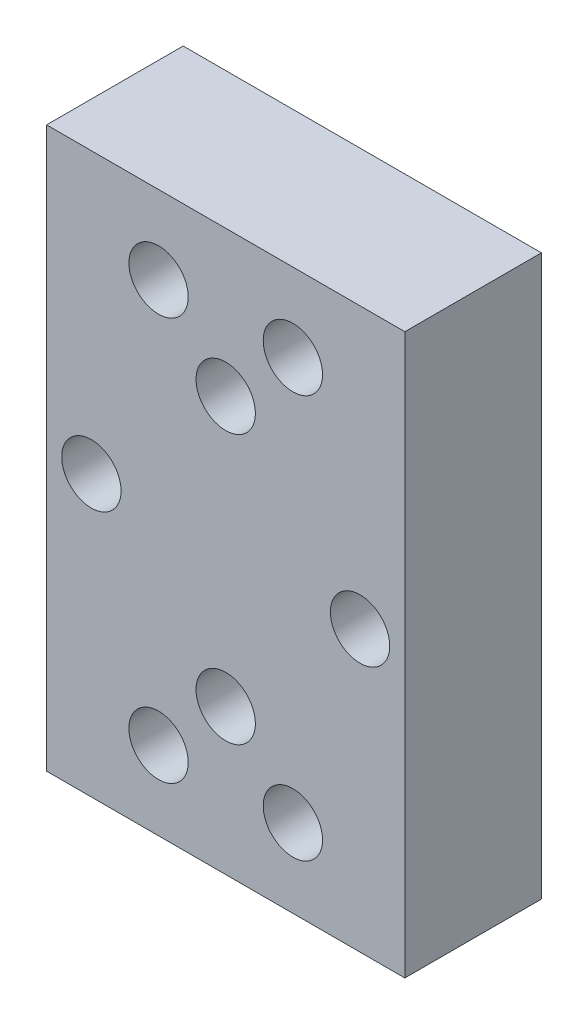
from build123d import *

# Parameters (mm, degrees)
SKETCH1_W           = 16
SKETCH1_H           = 25
SKETCH1_R           = 1.325
BOSS_EXTRUDE1_DEPTH = 6.1


with BuildPart() as part:
    # Sketch1 → Boss-Extrude1 (new body)
    with BuildSketch(Plane.XY):
        with Locations((8, 12.5)):
            Rectangle(SKETCH1_W, SKETCH1_H)
        with Locations((2, 12.5)):
            Circle(SKETCH1_R, mode=Mode.SUBTRACT)
        with Locations((8, 18.5)):
            Circle(SKETCH1_R, mode=Mode.SUBTRACT)
        with Locations((5, 21.5)):
            Circle(SKETCH1_R, mode=Mode.SUBTRACT)
        with Locations(Location((14, 12.5, 0), (0, 0, 180))):
            Circle(SKETCH1_R, mode=Mode.SUBTRACT)
        with Locations(Location((11, 21.5, 0), (0, 0, 180))):
            Circle(SKETCH1_R, mode=Mode.SUBTRACT)
        with Locations(Location((5, 3.5, 0), (0, 0, 180))):
            Circle(SKETCH1_R, mode=Mode.SUBTRACT)
        with Locations((11, 3.5)):
            Circle(SKETCH1_R, mode=Mode.SUBTRACT)
        with Locations(Location((8, 6.5, 0), (0, 0, 180))):
            Circle(SKETCH1_R, mode=Mode.SUBTRACT)
    extrude(amount=BOSS_EXTRUDE1_DEPTH)


solid = part.part
